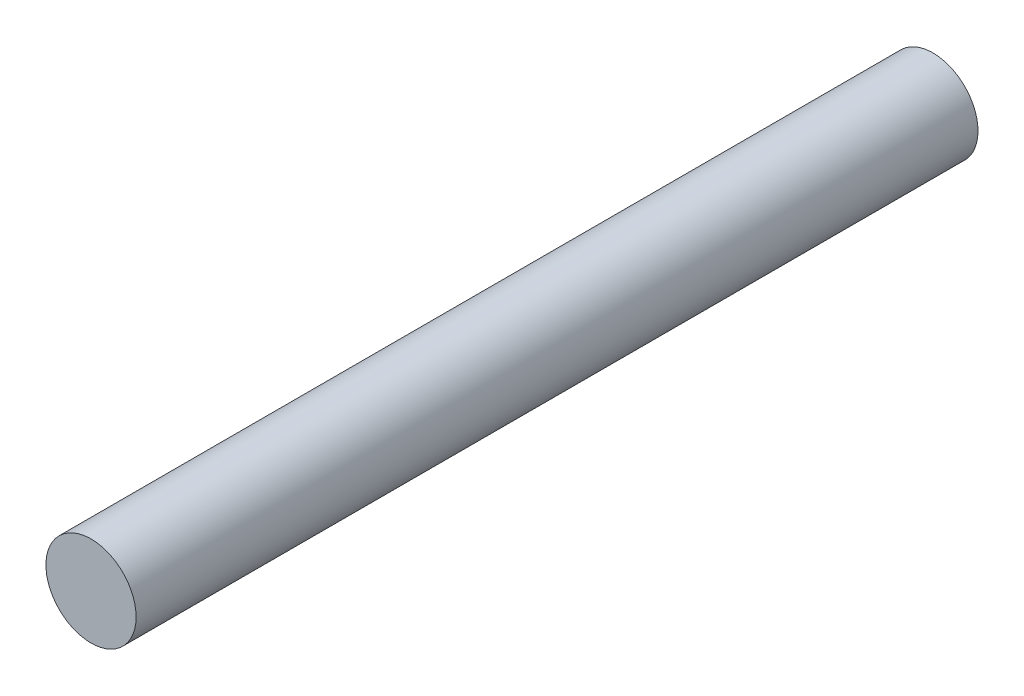
from build123d import *

# Parameters (mm, degrees)
CROQUIS1_R              = 9.525
SALIENTE_EXTRUIR1_DEPTH = 177.8


with BuildPart() as part:
    # Croquis1 → Saliente-Extruir1 (new body)
    with BuildSketch(Plane.XY):
        Circle(CROQUIS1_R)
    extrude(amount=SALIENTE_EXTRUIR1_DEPTH)


solid = part.part
